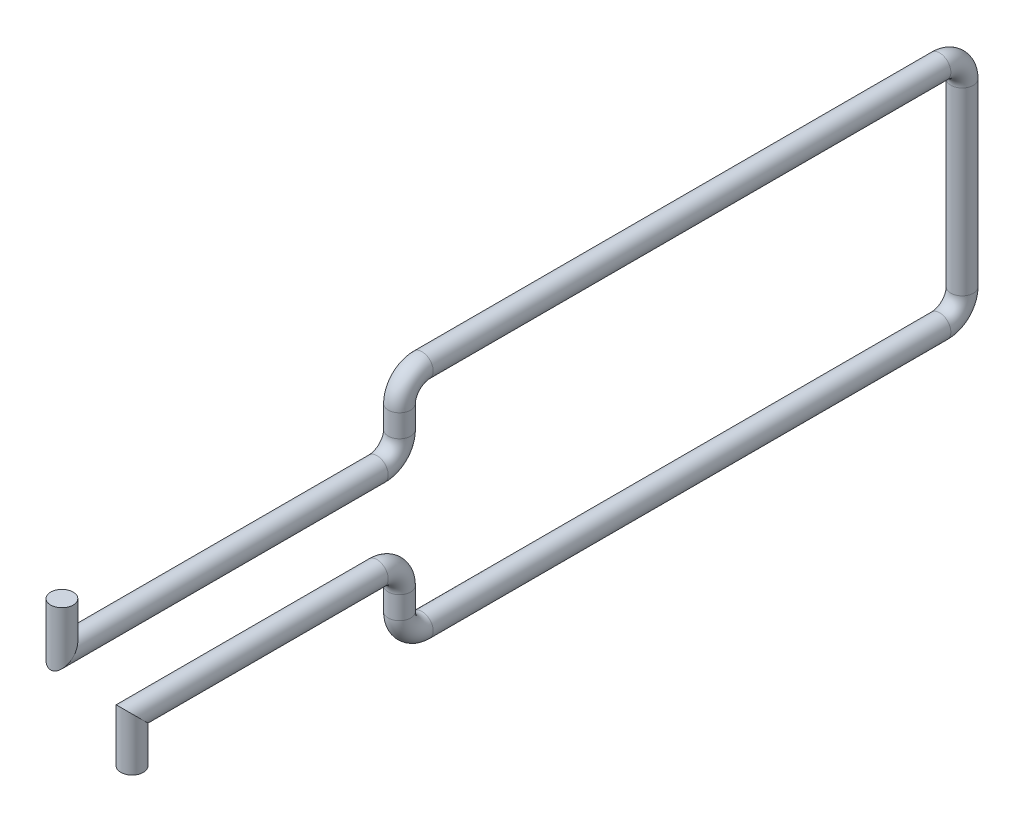
from build123d import *

# Parameters (mm, degrees)
SKIZZE5_R = 1


with BuildPart() as part:
    # Austragung1: sweep along a path in Skizze1
    with BuildLine(Plane(origin=(0, 0, 0), x_dir=(0, 0, -1), z_dir=(1, 0, 0))) as austragung1_path:
        Line((0, 8), (0, 4))
        Line((0, 4), (28, 4))
        ThreePointArc((28, 4), (29.414213562, 4.585786438), (30, 6))
        Line((30, 6), (30, 8))
        ThreePointArc((30, 8), (30.585786438, 9.414213562), (32, 10))
        Line((32, 10), (78, 10))
        ThreePointArc((78, 10), (79.414213562, 9.414213562), (80, 8))
        Line((80, 8), (80, -8))
        ThreePointArc((80, -8), (79.414213562, -9.414213562), (78, -10))
        Line((78, -10), (32, -10))
        ThreePointArc((32, -10), (30.585786438, -9.414213562), (30, -8))
        Line((30, -8), (30, -6))
        ThreePointArc((30, -6), (29.414213562, -4.585786438), (28, -4))
        Line((28, -4), (6.234882435, -4))
        Line((6.234882435, -4), (6.234882435, -8))
    # Skizze5 → Austragung1 (sweep)
    with BuildSketch(Plane(origin=(0, 8, 0), x_dir=(1, 0, 0), z_dir=(0, 1, 0))):
        Circle(SKIZZE5_R)
    sweep(path=austragung1_path.line, transition=Transition.RIGHT)


solid = part.part
